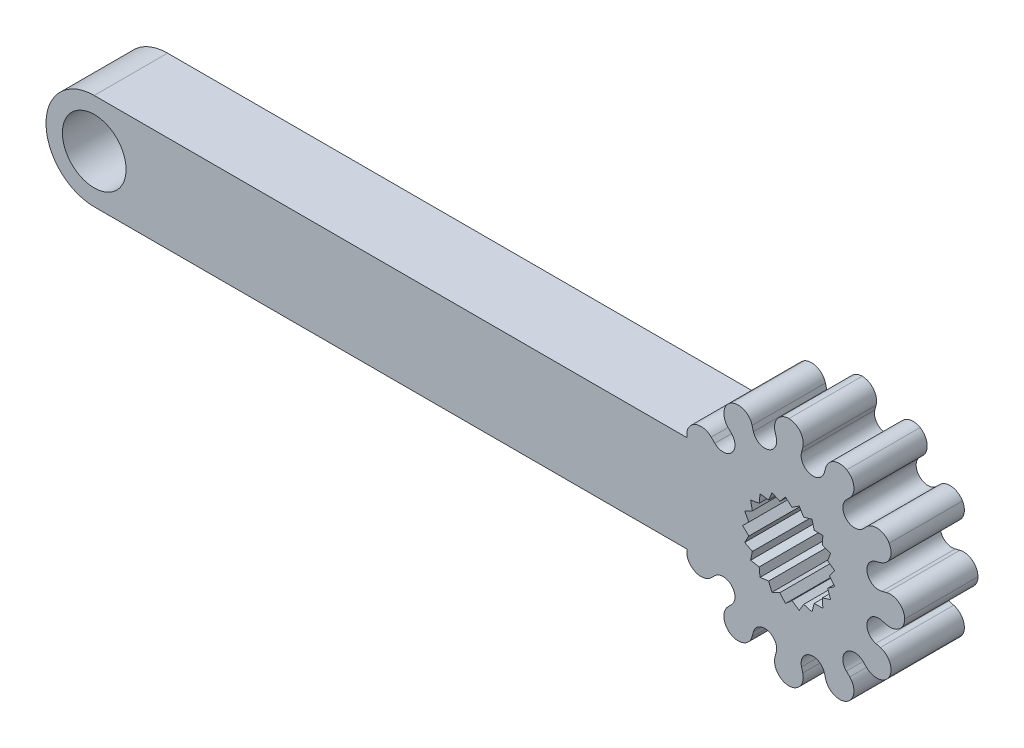
from build123d import *

# Parameters (mm, degrees)
SKETCH1_R           = 1.65
BOSS_EXTRUDE1_DEPTH = 3.8
CUT_EXTRUDE1_DEPTH  = 26.02878343
CIRPATTERN1_COUNT   = 12
SKETCH3_W           = 5.990659071
SKETCH3_H           = 5
BOSS_EXTRUDE2_DEPTH = 3.8
SKETCH4_R           = 2.1
CUT_EXTRUDE2_DEPTH  = 26.02878343
CUT_EXTRUDE3_DEPTH  = 10


with BuildPart() as part:
    # Sketch1 → Boss-Extrude1 (new body)
    with BuildSketch(Plane.XY):
        with BuildLine():
            Line((-18, 2.5), (12.545643943, 2.5))
            ThreePointArc((12.545643943, 2.5), (24, 0), (12.545643943, -2.5))
            Line((12.545643943, -2.5), (-18, -2.5))
            ThreePointArc((-18, -2.5), (-20.5, 0), (-18, 2.5))
        make_face()
        with Locations(Location((-18, 0, 0), (0, 0, 180))):
            Circle(SKETCH1_R, mode=Mode.SUBTRACT)
    extrude(amount=BOSS_EXTRUDE1_DEPTH)

    # Sketch2 → Cut-Extrude1 (cut, through all)
    with BuildSketch(Plane.XY.offset(3.8)):
        with BuildLine():
            ThreePointArc((21, 5.196152423), (19.633748274, 6.097231567), (18, 6))
            ThreePointArc((18, 6), (19.552914271, 5.795554958), (21, 5.196152423))
        make_face()
        with BuildLine():
            ThreePointArc((18, 6), (18.589879661, 5.706078038), (18.72, 5.06))
            Line((18.72, 5.06), (18.654523502, 4.81))
            ThreePointArc((18.654523502, 4.81), (19.09327028, 4.062778187), (19.840492093, 4.501524965))
            Line((19.840492093, 4.501524965), (19.906461709, 4.742088543))
            ThreePointArc((19.906461709, 4.742088543), (20.342188248, 5.236548367), (21, 5.196152423))
            ThreePointArc((21, 5.196152423), (19.552914271, 5.795554958), (18, 6))
        make_face()
    cut_extrude1 = extrude(amount=-CUT_EXTRUDE1_DEPTH, mode=Mode.SUBTRACT)

    # CirPattern1: Cut-Extrude1 ×12 about axis
    cirpattern1_axis = Axis((18, 0, 0), (0, 0, 1))
    for i in range(1, CIRPATTERN1_COUNT):
        add(cut_extrude1.rotate(cirpattern1_axis, i * 360 / CIRPATTERN1_COUNT), mode=Mode.SUBTRACT)

    # Sketch3 → Boss-Extrude2 (add)
    with BuildSketch(Plane.XY.offset(3.8)):
        with Locations((13.282390893, 0)):
            Rectangle(SKETCH3_W, SKETCH3_H)
    extrude(amount=-BOSS_EXTRUDE2_DEPTH)

    # Sketch4 → Cut-Extrude2 (cut, through all)
    with BuildSketch(Plane.XY.offset(3.8)):
        with Locations((18, 0)):
            Circle(SKETCH4_R)
    extrude(amount=-CUT_EXTRUDE2_DEPTH, mode=Mode.SUBTRACT)

    # Sketch5 → Cut-Extrude3 (cut)
    with BuildSketch(Plane.XY.offset(3.8)):
        Polygon((20.006712152, 0.618955846), (20.373196658, 0.357683687), (20.1, 0), (20.373191307, -0.35771919), (20.006702892, -0.618985866), (20.162317494, -1.041337148), (19.735101426, -1.182972122), (19.759312282, -1.63242773), (19.309328584, -1.641846113), (19.199984453, -2.078469945), (18.767216151, -1.954834872), (18.53403274, -2.339830984), (18.156933197, -2.094127974), (17.820629874, -2.393287772), (17.532706039, -2.047348616), (17.123164831, -2.234090438), (16.95, -1.818653348), (16.50361044, -1.876384365), (16.460591069, -1.428362749), (16.017016829, -1.351953307), (16.107965377, -0.911155852), (15.706619975, -0.707395264), (15.923455265, -0.312988759), (15.6, 1.7952e-05), (15.923455265, 0.312988759), (15.706630558, 0.707429573), (16.107965377, 0.911155852), (16.017037054, 1.351982972), (16.460591069, 1.428362749), (16.503638511, 1.876406751), (16.95, 1.818653348), (17.123198253, 2.234103555), (17.532706039, 2.047348616), (17.820665677, 2.393290455), (18.156933197, 2.094127974), (18.534067743, 2.339822994), (18.767216151, 1.954834872), (19.200015547, 2.078451993), (19.309328584, 1.641846113), (19.759336703, 1.632401411), (19.735101426, 1.182972122), (20.162333072, 1.0413048), align=None)
    extrude(amount=-CUT_EXTRUDE3_DEPTH, mode=Mode.SUBTRACT)


solid = part.part
